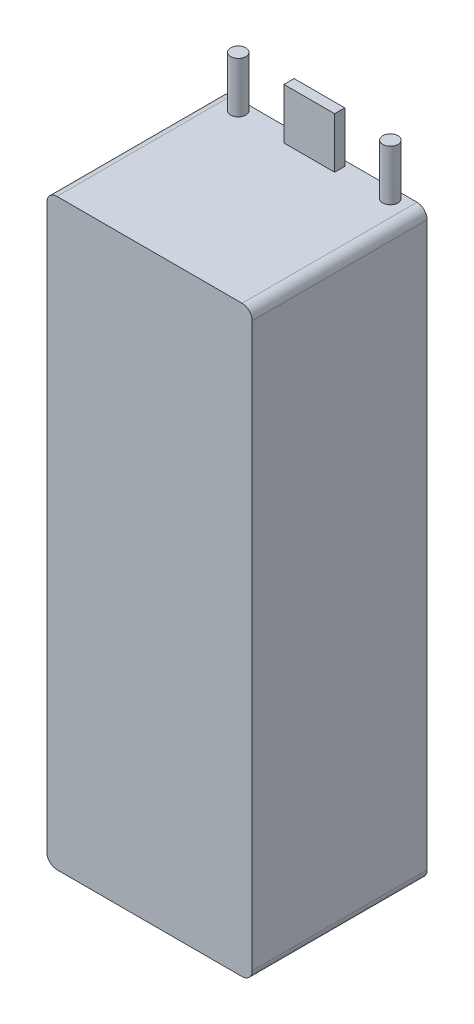
from build123d import *

# Parameters (mm, degrees)
SKETCH1_W           = 40.5
SKETCH1_H           = 34.5
BOSS_EXTRUDE1_DEPTH = 115
SKETCH2_R           = 1.5
SKETCH2_W           = 10
SKETCH2_H           = 2
BOSS_EXTRUDE2_DEPTH = 10
FILLET1_R           = 2


with BuildPart() as part:
    # Sketch1 → Boss-Extrude1 (new body)
    with BuildSketch(Plane(origin=(0, 0, 0), x_dir=(1, 0, 0), z_dir=(0, 1, 0))):
        Rectangle(SKETCH1_W, SKETCH1_H)
    extrude(amount=BOSS_EXTRUDE1_DEPTH)

    # Sketch2 → Boss-Extrude2 (add)
    with BuildSketch(Plane(origin=(0, 115, 0), x_dir=(1, 0, 0), z_dir=(0, 1, 0))):
        with Locations(Location((-15, 15.25, 0), (0, 0, 90))):
            Circle(SKETCH2_R)
        with Locations(Location((15, 15.25, 0), (0, 0, 90))):
            Circle(SKETCH2_R)
        with Locations((0, 15.25)):
            Rectangle(SKETCH2_W, SKETCH2_H)
    extrude(amount=BOSS_EXTRUDE2_DEPTH)

    # Fillet1
    fillet1_edges = [part.edges().sort_by_distance(p)[0] for p in [
        (-20.25, 115, 0),
        (20.25, 115, 0),
        (-20.25, 0, 0),
        (20.25, 0, 0),
    ]]
    fillet(fillet1_edges, radius=FILLET1_R)


solid = part.part
